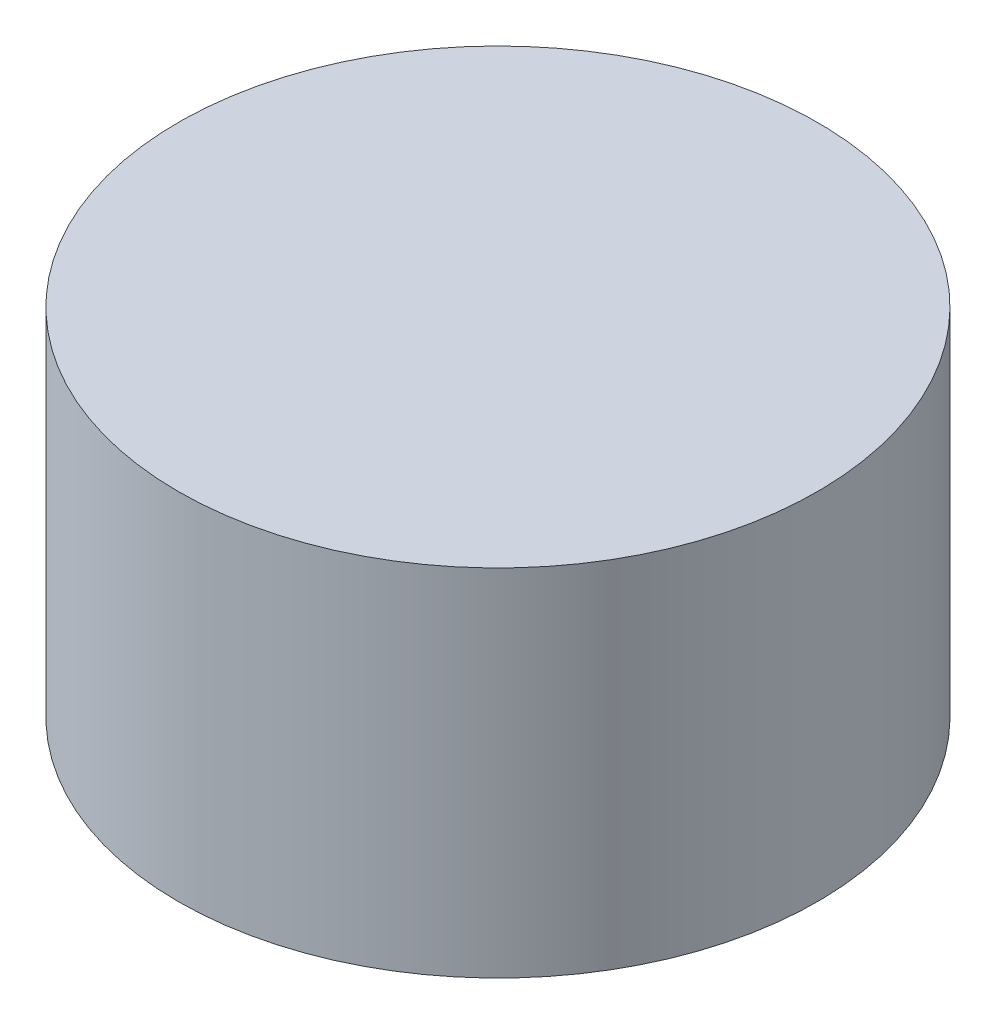
from build123d import *

# Parameters (mm, degrees)
SKETCH1_R           = 9
BOSS_EXTRUDE1_DEPTH = 10


with BuildPart() as part:
    # Sketch1 → Boss-Extrude1 (new body)
    with BuildSketch(Plane(origin=(0, 0, 0), x_dir=(1, 0, 0), z_dir=(0, 1, 0))):
        with Locations(Location((0, 0, 0), (0, 0, 270))):
            Circle(SKETCH1_R)
    extrude(amount=BOSS_EXTRUDE1_DEPTH)


solid = part.part
